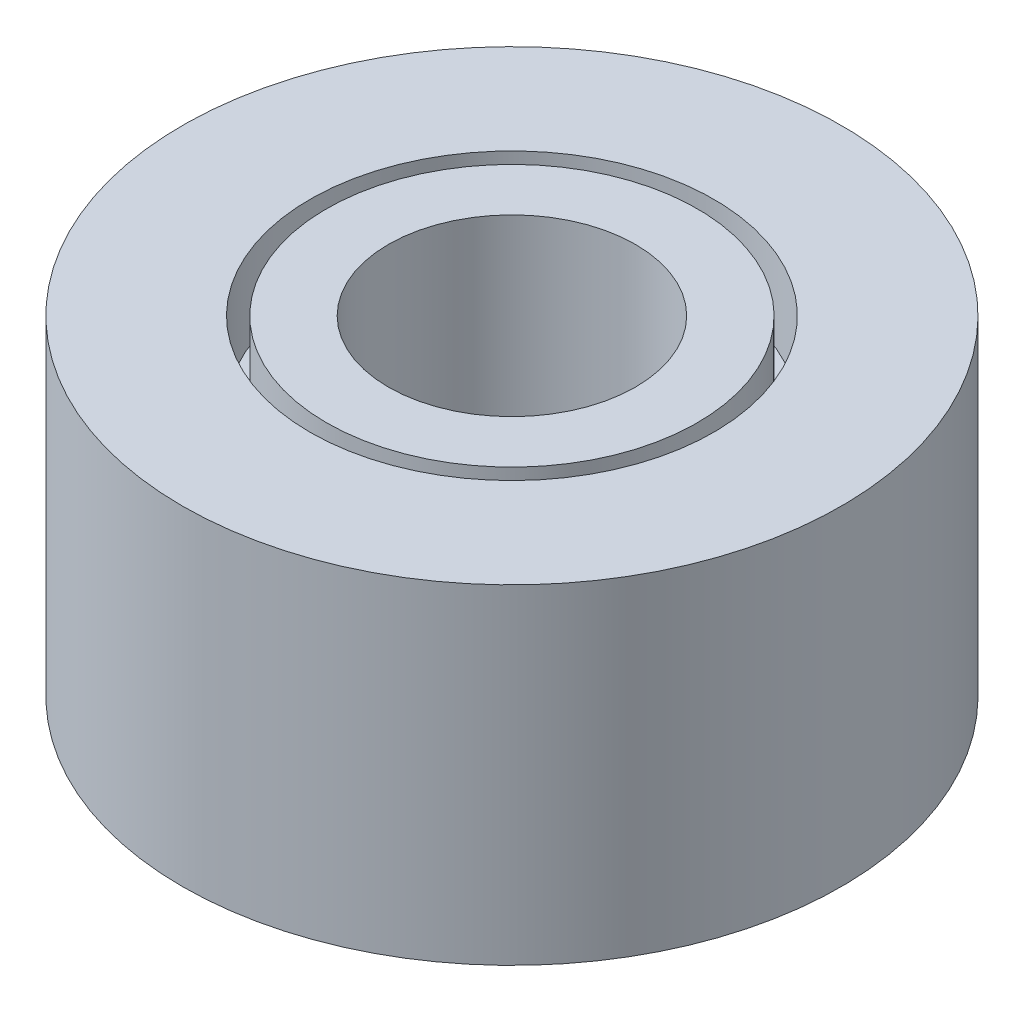
from build123d import *

# Parameters (mm, degrees)
SKETCH_1_R          = 4
SKETCH_1_R_2        = 1.5
EXTRUDE_1_DEPTH     = 4
SKETCH_1_3_R        = 2.45
SKETCH_1_3_R_2      = 2.25
CUT_EXTRUDE_1_DEPTH = 1
CUT_EXTRUDE_START   = 3
SKETCH_1_4_R        = 2.45
SKETCH_1_4_R_2      = 2.25
CUT_EXTRUDE_2_DEPTH = 1


with BuildPart() as part:
    # 草图1 → 凸台-拉伸1 (new body)
    with BuildSketch(Plane(origin=(0, 0, 0), x_dir=(1, 0, 0), z_dir=(0, 1, 0))):
        with Locations(Location((0, 0, 0), (0, 0, 270))):
            Circle(SKETCH_1_R)
        with Locations(Location((0, 0, 0), (0, 0, 270))):
            Circle(SKETCH_1_R_2, mode=Mode.SUBTRACT)
    extrude(amount=EXTRUDE_1_DEPTH)

    # 草图1<3> → 切除-拉伸-薄壁1 (cut)
    with BuildSketch(Plane(origin=(0, 0, 0), x_dir=(1, 0, 0), z_dir=(0, 1, 0))):
        Circle(SKETCH_1_3_R)
        Circle(SKETCH_1_3_R_2, mode=Mode.SUBTRACT)
    extrude(amount=CUT_EXTRUDE_1_DEPTH, mode=Mode.SUBTRACT)

    # 草图1<4> → 切除-拉伸-薄壁2 (cut)
    with BuildSketch(Plane(origin=(0, 0, 0), x_dir=(1, 0, 0), z_dir=(0, 1, 0)).offset(CUT_EXTRUDE_START)):
        Circle(SKETCH_1_4_R)
        Circle(SKETCH_1_4_R_2, mode=Mode.SUBTRACT)
    extrude(amount=CUT_EXTRUDE_2_DEPTH, mode=Mode.SUBTRACT)


solid = part.part
